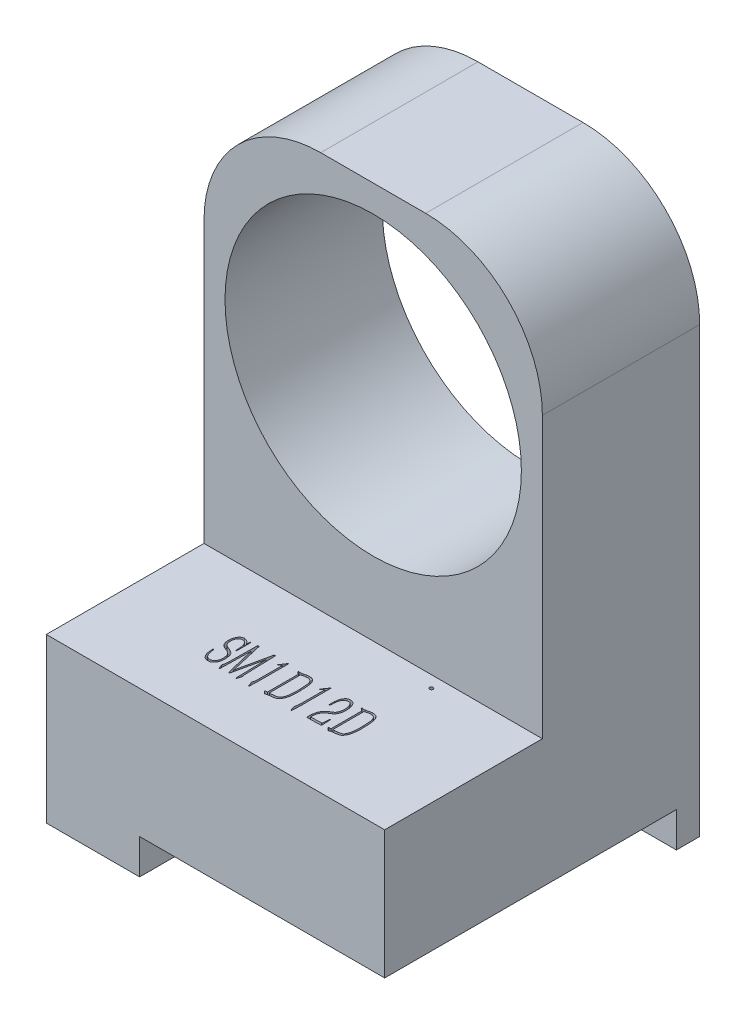
from build123d import *

# Parameters (mm, degrees)
SKETCH_1_W          = 29
SKETCH_1_H          = 29
EXTRUDE_1_DEPTH     = 5
SKETCH_2_W          = 25
SKETCH_2_H          = 25
CUT_EXTRUDE_1_DEPTH = 3
SKETCH_4_W          = 29
SKETCH_4_H          = 29
EXTRUDE_2_DEPTH     = 43
HOLE_WIZARD_M27_1_D = 25.4
CUT_EXTRUDE_START   = -15.516
SKETCH_10_R         = 18
CUT_EXTRUDE_2_DEPTH = 15.516
SKETCH_11_R         = 1
CUT_EXTRUDE_3_DEPTH = 3
CUT_EXTRUDE_4_DEPTH = 15.516
SKETCH_13_W         = 29
SKETCH_13_H         = 5
EXTRUDE_3_DEPTH     = 6
SKETCH_14_W         = 6
SKETCH_14_H         = 29
CUT_EXTRUDE_5_DEPTH = 50.794578018
SKETCH_15_W         = 29
SKETCH_15_H         = 2
CUT_EXTRUDE_6_DEPTH = 55.171025466
FILLET_1_R          = 10
CUT_EXTRUDE_7_REACH = 60.764
CUT_EXTRUDE_8_DEPTH = 0.5


with BuildPart() as part:
    # 草图1 → 凸台-拉伸1 (new body)
    with BuildSketch(Plane(origin=(0, 0, 0), x_dir=(1, 0, 0), z_dir=(0, 1, 0))):
        Rectangle(SKETCH_1_W, SKETCH_1_H)
    extrude(amount=EXTRUDE_1_DEPTH)

    # 草图2 → 切除-拉伸1 (cut)
    with BuildSketch(Plane.XZ):
        Rectangle(SKETCH_2_W, SKETCH_2_H)
    extrude(amount=-CUT_EXTRUDE_1_DEPTH, mode=Mode.SUBTRACT)

    # 草图4 → 凸台-拉伸2 (add)
    with BuildSketch(Plane(origin=(0, 5, 0), x_dir=(1, 0, 0), z_dir=(0, 1, 0))):
        with Locations((-6, 0)):
            Rectangle(SKETCH_4_W, SKETCH_4_H)
    extrude(amount=EXTRUDE_2_DEPTH)

    # 草图7 → M4 螺纹孔1 (revolve, cut)
    with BuildSketch(Plane(origin=(0, 3, 0), x_dir=(0, 0, -1), z_dir=(1, 0, 0))):
        Polygon((0, 0), (0, 11.091420021), (1.65, 10.1), (1.65, 0), align=None)
    revolve(axis=Axis((0, -3.35, 0), (0, 1, 0)), mode=Mode.SUBTRACT)

    # M27 螺纹孔1 (through all)
    with Locations(Plane(origin=(-6, 33, 14.5), x_dir=(1, 0, 0), z_dir=(0, 0, 1))):
        with Locations((0, 0)):
            Hole(HOLE_WIZARD_M27_1_D / 2)

    # 草图10 → 切除-拉伸2 (cut)
    with BuildSketch(Plane.XY.offset(14.5).offset(CUT_EXTRUDE_START)):
        with Locations((-6, 33)):
            Circle(SKETCH_10_R)
    extrude(amount=CUT_EXTRUDE_2_DEPTH, mode=Mode.SUBTRACT)

    # 草图11 → 切除-拉伸3 (cut)
    with BuildSketch(Plane(origin=(0, 0, 0), x_dir=(-1, 0, 0), z_dir=(0, -1, 0))):
        with Locations((12.5, 12.5)):
            Circle(SKETCH_11_R)
    extrude(amount=-CUT_EXTRUDE_3_DEPTH, mode=Mode.SUBTRACT)

    # 草图12 → 切除-拉伸4 (cut)
    with BuildSketch(Plane.XY.offset(14.5).offset(CUT_EXTRUDE_START)):
        with BuildLine():
            Line((-20.5, 48), (-20.5, 43.665364504))
            ThreePointArc((-20.5, 43.665364504), (-18.415569073, 46.032791128), (-15.949874371, 48))
            Line((-15.949874371, 48), (-20.5, 48))
        make_face()
        with BuildLine():
            Line((8.5, 48), (3.949874371, 48))
            ThreePointArc((3.949874371, 48), (6.415569073, 46.032791128), (8.5, 43.665364504))
            Line((8.5, 43.665364504), (8.5, 48))
        make_face()
    extrude(amount=CUT_EXTRUDE_4_DEPTH, mode=Mode.SUBTRACT)

    # 草图13 → 凸台-拉伸3 (add)
    with BuildSketch(Plane.ZY.offset(14.5)):
        with Locations((0, 2.5)):
            Rectangle(SKETCH_13_W, SKETCH_13_H)
    extrude(amount=EXTRUDE_3_DEPTH)

    # 草图14 → 切除-拉伸5 (cut, through all)
    with BuildSketch(Plane(origin=(0, 5, 0), x_dir=(1, 0, 0), z_dir=(0, 1, 0))):
        with Locations((11.5, 0)):
            Rectangle(SKETCH_14_W, SKETCH_14_H)
    extrude(amount=-CUT_EXTRUDE_5_DEPTH, mode=Mode.SUBTRACT)

    # 草图15 → 切除-拉伸6 (cut, through all)
    with BuildSketch(Plane.XZ):
        with Locations((-6, 13.5)):
            Rectangle(SKETCH_15_W, SKETCH_15_H)
    extrude(amount=-CUT_EXTRUDE_6_DEPTH, mode=Mode.SUBTRACT)

    # 圆角1
    fillet_1_edges = [part.edges().sort_by_distance(p)[0] for p in [
        (-20.5, 48, -7.758),
        (8.5, 48, -7.758),
    ]]
    fillet(fillet_1_edges, radius=FILLET_1_R)

    # 切除-拉伸7: up to this face of the body (flat: up to its plane)
    cut_extrude_7_end = Plane(part.part.faces().sort_by_distance((-6, 47.560682347, -1.016))[0])
    # 草图16 → 切除-拉伸7 (cut, up to the picked face)
    with BuildSketch(Plane.XY.offset(12.5), mode=Mode.PRIVATE) as cut_extrude_7_sk1:
        with BuildLine():
            Line((-20.5, 22.334635496), (-20.5, 14))
            Line((-20.5, 14), (8.5, 14))
            Line((8.5, 14), (8.5, 22.334635496))
            ThreePointArc((8.5, 22.334635496), (-6, 15), (-20.5, 22.334635496))
        make_face()
    cut_extrude_7_tool1 = split(extrude(cut_extrude_7_sk1.sketch, amount=-CUT_EXTRUDE_7_REACH, mode=Mode.PRIVATE), bisect_by=cut_extrude_7_end, keep=Keep.BOTH, mode=Mode.PRIVATE)
    add(cut_extrude_7_tool1.solids().sort_by(Axis((-20.198261, 18.167318, 12.5), (0, 0, -1)))[0], mode=Mode.SUBTRACT)

    # 草图17 → 切除-拉伸8 (cut)
    # profile 1 of 7: a face of its own
    with BuildSketch(Plane(origin=(0, 14, 0), x_dir=(1, 0, 0), z_dir=(0, 1, 0))):
        with BuildLine():
            Line((-11.230759471, -4.627887886), (-11.180045642, -4.320621745))
            Line((-11.180045642, -4.320621745), (-11.130077604, -4.325842286))
            Line((-11.130077604, -4.325842286), (-11.130077604, -5.583992723))
            Line((-11.130077604, -5.583992723), (-11.190486724, -5.589213264))
            Line((-11.190486724, -5.589213264), (-11.225538929, -5.055972267))
            add(Edge.make_bspline(
                [(-11.225538929, -5.055972267), (-11.230154048, -5.026320074), (-11.23868524, -4.971507064), (-11.255408188, -4.897277935), (-11.270918756, -4.836533639), (-11.29495314, -4.774974732), (-11.330618835, -4.709252596), (-11.383154237, -4.638808805), (-11.446187294, -4.575353336), (-11.520937108, -4.525436973), (-11.601955167, -4.48728667), (-11.660203779, -4.480036198), (-11.688675516, -4.47649219)],
                knots=[0, 0, 0, 0, 1.116474761, 2.063838624, 2.831507158, 3.446633667, 4.518832044, 5.603216916, 6.708904972, 7.82779241, 8.938231816, 10, 10, 10, 10], degree=3))
            add(Edge.make_bspline(
                [(-11.688675516, -4.47649219), (-11.705638791, -4.477219301), (-11.740466382, -4.478712143), (-11.784184532, -4.488994113), (-11.821442957, -4.502630548), (-11.852255832, -4.520174232), (-11.886147385, -4.543670742), (-11.921551588, -4.572839476), (-11.957151012, -4.606169407), (-11.988724336, -4.64490384), (-12.01644151, -4.687319718), (-12.046163147, -4.748459815), (-12.075759347, -4.826386556), (-12.095324484, -4.907097934), (-12.103876431, -4.974568079), (-12.109129452, -5.031531607), (-12.112502689, -5.095465788), (-12.11546211, -5.164596659), (-12.112918722, -5.235818315), (-12.102656267, -5.305466686), (-12.084179896, -5.371732423), (-12.065579187, -5.412912205), (-12.056350777, -5.433342819)],
                knots=[0, 0, 0, 0, 0.864038106, 1.773971445, 2.275285977, 2.88209936, 3.574564674, 4.376127188, 5.218616224, 6.055847121, 6.916999662, 7.795414815, 9.515900782, 11.157236165, 12.013901558, 12.981067707, 14.072720019, 15.277182195, 16.507433409, 17.699229733, 18.858513907, 20, 20, 20, 20], degree=3))
            add(Edge.make_bspline(
                [(-12.056350777, -5.433342819), (-12.045902313, -5.452288448), (-12.025526211, -5.489235322), (-11.98741809, -5.538424567), (-11.942663745, -5.578291249), (-11.879801158, -5.618908577), (-11.804396117, -5.655209814), (-11.744959602, -5.679212607), (-11.71850718, -5.689895131)],
                knots=[0, 0, 0, 0, 0.892298636, 1.740118821, 2.553971753, 3.353728668, 4.822268012, 6, 6, 6, 6], degree=3))
            Line((-11.71850718, -5.689895131), (-11.542500361, -5.760745333))
            add(Edge.make_bspline(
                [(-11.542500361, -5.760745333), (-11.520785551, -5.770759827), (-11.478975067, -5.790042096), (-11.420047043, -5.820717471), (-11.36669571, -5.851051349), (-11.305309901, -5.892136848), (-11.237670068, -5.946097972), (-11.170834456, -6.020518044), (-11.116524201, -6.104857081), (-11.082457437, -6.203195204), (-11.055626043, -6.309875611), (-11.037509207, -6.425768627), (-11.025547854, -6.552294289), (-11.020740111, -6.687660857), (-11.022869344, -6.827545569), (-11.04075077, -6.918862573), (-11.049532111, -6.963707191)],
                knots=[0, 0, 0, 0, 0.703245545, 1.354054533, 1.953549274, 2.507188807, 3.525842386, 4.488918984, 5.43838142, 6.454223102, 7.53246407, 8.673253088, 9.899948524, 11.268249991, 12.658472344, 14, 14, 14, 14], degree=3))
            add(Edge.make_bspline(
                [(-11.049532111, -6.963707191), (-11.060511527, -7.008680579), (-11.081777991, -7.095791302), (-11.127788535, -7.195874943), (-11.168119736, -7.266647726), (-11.197998015, -7.31251353), (-11.227874419, -7.351928977), (-11.266920779, -7.398185552), (-11.327141247, -7.446946465), (-11.397400281, -7.485775141), (-11.462073432, -7.509915701), (-11.515754477, -7.523717012), (-11.573390948, -7.530712447), (-11.613086271, -7.532055796), (-11.633486937, -7.532746186)],
                knots=[0, 0, 0, 0, 1.868422262, 3.619020558, 4.429541533, 5.162879566, 5.830420081, 6.429075538, 7.606854402, 8.938752151, 9.657684361, 10.394048182, 11.174651193, 12, 12, 12, 12], degree=3))
            add(Edge.make_bspline(
                [(-11.633486937, -7.532746186), (-11.656395889, -7.532600451), (-11.701235787, -7.532315204), (-11.766839553, -7.521704359), (-11.828747589, -7.502283782), (-11.886397581, -7.473407911), (-11.940315098, -7.437341889), (-11.99039047, -7.394559442), (-12.036702454, -7.34551203), (-12.080434533, -7.291148434), (-12.118740341, -7.229762329), (-12.153353475, -7.162999026), (-12.182959141, -7.090515171), (-12.216151675, -6.988216161), (-12.245319009, -6.858260176), (-12.253661679, -6.753046612), (-12.25771451, -6.701934338)],
                knots=[0, 0, 0, 0, 0.833862414, 1.63212638, 2.411403016, 3.189256699, 3.973153178, 4.770028097, 5.583768076, 6.428386665, 7.307987397, 8.215552436, 9.166047206, 10.157242313, 12.13320567, 14, 14, 14, 14], degree=3))
            Line((-12.25771451, -6.701934338), (-12.277850883, -6.434940944))
            Line((-12.277850883, -6.434940944), (-12.207000681, -6.434940944))
            add(Edge.make_bspline(
                [(-12.207000681, -6.434940944), (-12.202925157, -6.466534138), (-12.195084427, -6.527314972), (-12.181307669, -6.614992202), (-12.168028613, -6.695813655), (-12.1510542, -6.79240261), (-12.124499434, -6.901510469), (-12.082665171, -7.020084365), (-12.028035983, -7.124142569), (-11.969670913, -7.197240348), (-11.919478846, -7.248095515), (-11.87946501, -7.277292503), (-11.840486539, -7.302514596), (-11.787659457, -7.324087132), (-11.721836891, -7.341323784), (-11.668896165, -7.34115818), (-11.643182228, -7.341077743)],
                knots=[0, 0, 0, 0, 1.134650933, 2.182907786, 3.161205505, 4.052250561, 5.675932663, 7.155002512, 8.52184542, 9.839854562, 10.472309825, 11.060302883, 11.600982628, 12.120735338, 13.087218943, 14, 14, 14, 14], degree=3))
            add(Edge.make_bspline(
                [(-11.643182228, -7.341077743), (-11.620485304, -7.340266466), (-11.576946565, -7.33871022), (-11.514683758, -7.325495017), (-11.457966048, -7.305242878), (-11.407991444, -7.274158331), (-11.363173653, -7.236637803), (-11.322733624, -7.192753859), (-11.285670326, -7.143325943), (-11.254763081, -7.08783551), (-11.227477115, -7.030475855), (-11.205050965, -6.973465497), (-11.188415664, -6.917801751), (-11.17713747, -6.862853766), (-11.169487995, -6.806031606), (-11.16558978, -6.745496631), (-11.162746874, -6.679819602), (-11.164312653, -6.634565304), (-11.165129809, -6.610947762)],
                knots=[0, 0, 0, 0, 1.108065456, 2.12556444, 3.098260599, 4.035950869, 4.98490885, 5.94776606, 6.946521194, 7.996930623, 9.045863326, 10.049925535, 10.987930625, 11.881525266, 12.788809675, 13.787786499, 14.845478855, 16, 16, 16, 16], degree=3))
            add(Edge.make_bspline(
                [(-11.165129809, -6.610947762), (-11.167740786, -6.574086098), (-11.172613975, -6.505286594), (-11.188416593, -6.410595112), (-11.207706944, -6.331058315), (-11.233448328, -6.265682163), (-11.264721679, -6.211631861), (-11.297589, -6.163049501), (-11.334634172, -6.119729215), (-11.376843218, -6.081992007), (-11.423215236, -6.047009075), (-11.475427827, -6.014477505), (-11.533908224, -5.983574965), (-11.575907309, -5.966002161), (-11.59768894, -5.956888525)],
                knots=[0, 0, 0, 0, 1.578487453, 2.946127177, 4.097996722, 5.070650713, 5.936469873, 6.761635482, 7.575228913, 8.364955199, 9.176673428, 10.055112166, 10.991339211, 12, 12, 12, 12], degree=3))
            Line((-11.59768894, -5.956888525), (-11.814714297, -5.876343032))
            add(Edge.make_bspline(
                [(-11.814714297, -5.876343032), (-11.848485274, -5.861580497), (-11.915405385, -5.832327257), (-12.006745666, -5.773162931), (-12.086336427, -5.701541452), (-12.150428742, -5.614603316), (-12.19964637, -5.513380133), (-12.22971543, -5.418547096), (-12.246463568, -5.333346791), (-12.253915124, -5.260723641), (-12.258810356, -5.180833743), (-12.258091422, -5.125338969), (-12.25771451, -5.096245014)],
                knots=[0, 0, 0, 0, 1.141640751, 2.262259852, 3.359181592, 4.444772656, 5.58953336, 6.835542724, 7.519006772, 8.279340868, 9.097919025, 10, 10, 10, 10], degree=3))
            add(Edge.make_bspline(
                [(-12.25771451, -5.096245014), (-12.257501968, -5.07112757), (-12.257091106, -5.022573361), (-12.251869242, -4.952331104), (-12.242996471, -4.887593389), (-12.227098454, -4.808559849), (-12.19864979, -4.715745427), (-12.154457419, -4.611841173), (-12.103246691, -4.519032321), (-12.044373754, -4.441205344), (-11.977159363, -4.380355545), (-11.915965095, -4.338230618), (-11.860375154, -4.313211596), (-11.812707716, -4.299684036), (-11.759725923, -4.292796062), (-11.722750397, -4.291474734), (-11.703591348, -4.290790081)],
                knots=[0, 0, 0, 0, 0.971164436, 1.877345498, 2.721647718, 3.496542433, 4.992871533, 6.466013358, 7.856401207, 9.083219229, 10.219456221, 11.349985082, 11.939558551, 12.569451447, 13.258754286, 14, 14, 14, 14], degree=3))
            add(Edge.make_bspline(
                [(-11.703591348, -4.290790081), (-11.682117158, -4.29323293), (-11.63940792, -4.298091424), (-11.57676368, -4.315069609), (-11.516162598, -4.339447376), (-11.459566634, -4.372540608), (-11.40751592, -4.409389102), (-11.36068149, -4.447636166), (-11.322402784, -4.489018801), (-11.301337548, -4.51829424), (-11.291168591, -4.532426561)],
                knots=[0, 0, 0, 0, 1.049956055, 2.088219507, 3.145806661, 4.218152357, 5.268178035, 6.24663062, 7.15358473, 8, 8, 8, 8], degree=3))
            Line((-11.291168591, -4.532426561), (-11.230759471, -4.627887886))
        make_face()
    # profile 2 of 7: a face of its own
    with BuildSketch(Plane(origin=(0, 14, 0), x_dir=(1, 0, 0), z_dir=(0, 1, 0))):
        with BuildLine():
            Line((-9.209664222, -4.265433166), (-9.094066524, -4.265433166))
            Line((-9.094066524, -4.265433166), (-9.023962113, -6.626609386))
            Line((-9.023962113, -6.626609386), (-9.018741572, -6.848109493))
            add(Edge.make_bspline(
                [(-9.018741572, -6.848109493), (-9.018486663, -6.872722364), (-9.018053661, -6.914531131), (-9.014655278, -6.970663256), (-9.006934874, -7.017419387), (-8.997097796, -7.061872872), (-8.984070144, -7.104098519), (-8.970587225, -7.140371785), (-8.956837315, -7.166912875), (-8.949555741, -7.187951484), (-8.953001974, -7.20807972), (-8.958883315, -7.23363563), (-8.97266093, -7.270455813), (-8.982538051, -7.299294274), (-8.988164116, -7.315720829)],
                knots=[0, 0, 0, 0, 1.833532234, 3.114538037, 4.183068399, 5.360011406, 6.502211209, 7.47535404, 8.229329157, 8.745810393, 9.081162989, 9.727925243, 10.705812996, 12, 12, 12, 12], degree=3))
            Line((-8.988164116, -7.315720829), (-9.044098486, -7.487252898))
            add(Edge.make_bspline(
                [(-9.044098486, -7.487252898), (-9.050245826, -7.502940604), (-9.061109396, -7.530663896), (-9.075998395, -7.566250574), (-9.086458288, -7.590616144), (-9.096306938, -7.606234691), (-9.106836794, -7.614471339), (-9.119503478, -7.617324023), (-9.129210796, -7.609010386), (-9.132468192, -7.601782068), (-9.13433927, -7.597630055)],
                knots=[0, 0, 0, 0, 2.257142557, 3.988819353, 5.165733309, 5.812331029, 6.431774305, 6.935717094, 7.388666149, 8, 8, 8, 8], degree=3))
            add(Edge.make_bspline(
                [(-9.13433927, -7.597630055), (-9.137484025, -7.591528176), (-9.145486443, -7.576000802), (-9.145549358, -7.543229879), (-9.145485078, -7.49940859), (-9.141696463, -7.465885854), (-9.139559812, -7.446980151)],
                knots=[0, 0, 0, 0, 0.533370556, 1.357261302, 2.50958371, 4, 4, 4, 4], degree=3))
            Line((-9.139559812, -7.446980151), (-9.149255102, -7.130018719))
            Line((-9.149255102, -7.130018719), (-9.209664222, -4.950069859))
            Line((-9.209664222, -4.950069859), (-9.773482675, -7.507389271))
            Line((-9.773482675, -7.507389271), (-9.869689792, -7.50216873))
            Line((-9.869689792, -7.50216873), (-10.478255742, -4.979901523))
            Line((-10.478255742, -4.979901523), (-10.518528488, -7.154629842))
            Line((-10.518528488, -7.154629842), (-10.528969571, -7.467116524))
            add(Edge.make_bspline(
                [(-10.528969571, -7.467116524), (-10.529091888, -7.489802118), (-10.529310727, -7.530388901), (-10.536542342, -7.576976696), (-10.543678383, -7.60590114), (-10.54916414, -7.618939465), (-10.555524457, -7.628598208), (-10.561364856, -7.628329673), (-10.564021776, -7.628207511)],
                knots=[0, 0, 0, 0, 2.35867652, 4.21990684, 4.917432392, 5.427710553, 5.739653463, 6, 6, 6, 6], degree=3))
            add(Edge.make_bspline(
                [(-10.564021776, -7.628207511), (-10.567520782, -7.627609188), (-10.574844959, -7.626356767), (-10.588609068, -7.620152711), (-10.599048768, -7.596752965), (-10.607804963, -7.571074394), (-10.615825648, -7.546000526), (-10.619973439, -7.529963573), (-10.623590453, -7.519709274), (-10.624223846, -7.514358825), (-10.624430896, -7.512609812)],
                knots=[0, 0, 0, 0, 0.61831469, 1.294266409, 2.516485019, 4.811391437, 6.122679461, 7.065853468, 7.69463614, 8, 8, 8, 8], degree=3))
            Line((-10.624430896, -7.512609812), (-10.715417472, -7.285889165))
            add(Edge.make_bspline(
                [(-10.715417472, -7.285889165), (-10.717873706, -7.274514324), (-10.722697828, -7.252173772), (-10.721798053, -7.216757798), (-10.712269383, -7.17933894), (-10.698061762, -7.140407806), (-10.683606493, -7.104756316), (-10.673337322, -7.078595541), (-10.667505891, -7.058664738), (-10.665286306, -7.038541343), (-10.661891267, -7.012265601), (-10.660255333, -6.981351541), (-10.658395147, -6.950500781), (-10.655712852, -6.923956074), (-10.654687474, -6.904004199), (-10.652893383, -6.890135631), (-10.651797316, -6.878205757), (-10.651150396, -6.864024052), (-10.650621427, -6.843620225), (-10.648580159, -6.81706245), (-10.648585901, -6.784202566), (-10.646353762, -6.745458683), (-10.646287824, -6.700431065), (-10.645166908, -6.668371103), (-10.644567269, -6.651220509)],
                knots=[0, 0, 0, 0, 1.187984124, 2.333238898, 3.586201942, 5.123185855, 6.573707022, 7.523685523, 7.99901539, 8.693496643, 9.589827362, 10.711954829, 11.85946849, 12.753267707, 13.442133117, 13.902940376, 14.183976602, 14.668078378, 15.355532658, 16.272922794, 17.392740166, 18.716797284, 20.243638767, 22, 22, 22, 22], degree=3))
            Line((-10.644567269, -6.651220509), (-10.609515064, -4.265433166))
            Line((-10.609515064, -4.265433166), (-10.488696824, -4.265433166))
            Line((-10.488696824, -4.265433166), (-9.829417046, -7.114357096))
            Line((-9.829417046, -7.114357096), (-9.209664222, -4.265433166))
        make_face()
    # profile 3 of 7: a face of its own
    with BuildSketch(Plane(origin=(0, 14, 0), x_dir=(1, 0, 0), z_dir=(0, 1, 0))):
        with BuildLine():
            Line((-7.990294949, -4.29526483), (-7.93510637, -4.29526483))
            Line((-7.93510637, -4.29526483), (-7.940326912, -6.968927733))
            add(Edge.make_bspline(
                [(-7.940326912, -6.968927733), (-7.940921629, -6.993040022), (-7.942061934, -7.039272652), (-7.942154479, -7.105419556), (-7.944329891, -7.165309442), (-7.944503162, -7.219028056), (-7.946120764, -7.266505221), (-7.947991364, -7.30775087), (-7.948169106, -7.342842319), (-7.951477863, -7.397764965), (-7.955420686, -7.473279508), (-7.965198681, -7.551058203), (-7.972982701, -7.606478779), (-7.980895798, -7.631707193), (-7.990920881, -7.651668741), (-8.000925894, -7.649340857), (-8.005210781, -7.648343884)],
                knots=[0, 0, 0, 0, 1.45038606, 2.780953852, 3.977268029, 5.053718292, 6.010937745, 6.833690271, 7.536464333, 8.120251454, 10.142880859, 12.069479857, 12.873132744, 13.440417135, 13.76034519, 14, 14, 14, 14], degree=3))
            add(Edge.make_bspline(
                [(-8.005210781, -7.648343884), (-8.00620131, -7.647594122), (-8.010441017, -7.644384954), (-8.020551544, -7.637592327), (-8.032564936, -7.619384287), (-8.037823648, -7.60304923), (-8.041008778, -7.593155306)],
                knots=[0, 0, 0, 0, 0.221265066, 0.947068446, 2.150880552, 4, 4, 4, 4], degree=3))
            Line((-8.041008778, -7.593155306), (-8.065619901, -7.527525644))
            Line((-8.065619901, -7.527525644), (-8.121554271, -7.346298285))
            add(Edge.make_bspline(
                [(-8.121554271, -7.346298285), (-8.128287563, -7.329246657), (-8.14001661, -7.299543603), (-8.151848629, -7.260465109), (-8.160824798, -7.23551184), (-8.163210592, -7.21528613), (-8.151718214, -7.196314361), (-8.143254472, -7.167103621), (-8.130231035, -7.129818033), (-8.117932449, -7.085810936), (-8.107069898, -7.038261963), (-8.097284633, -6.986886792), (-8.091739042, -6.929004059), (-8.089018714, -6.8737382), (-8.086931024, -6.820528765), (-8.086551723, -6.769302902), (-8.08550556, -6.708649913), (-8.085668991, -6.664894029), (-8.085756274, -6.641525218)],
                knots=[0, 0, 0, 0, 1.220359697, 2.125803599, 2.712350858, 2.994193817, 3.439826662, 4.12562012, 5.031064022, 6.063176816, 7.167225426, 8.277459231, 9.542238136, 11.034069985, 11.961482632, 13.08703073, 14.444263491, 16, 16, 16, 16], degree=3))
            Line((-8.085756274, -6.641525218), (-8.081281525, -4.668160633))
            Line((-8.081281525, -4.668160633), (-8.343054378, -4.89488128))
            Line((-8.343054378, -4.89488128), (-8.363190751, -4.809115246))
            add(Edge.make_bspline(
                [(-8.363190751, -4.809115246), (-8.341912313, -4.787128127), (-8.302025001, -4.745912365), (-8.248717873, -4.686569076), (-8.204874624, -4.635068501), (-8.159208956, -4.574861915), (-8.108081031, -4.499935194), (-8.070324671, -4.438377215), (-8.050704069, -4.40638778)],
                knots=[0, 0, 0, 0, 1.077185482, 2.019228619, 2.808185376, 3.45765616, 4.678836699, 6, 6, 6, 6], degree=3))
            Line((-8.050704069, -4.40638778), (-7.990294949, -4.29526483))
        make_face()
    # profile 4 of 7: a face of its own
    with BuildSketch(Plane(origin=(0, 14, 0), x_dir=(1, 0, 0), z_dir=(0, 1, 0))):
        with BuildLine():
            add(Edge.make_bspline(
                [(-6.745568761, -4.65771955), (-6.758694537, -4.65186981), (-6.781418253, -4.641742573), (-6.802355178, -4.628331748), (-6.811198422, -4.622667345)],
                knots=[0, 0, 0, 0, 1.155249011, 2, 2, 2, 2], degree=3))
            Line((-6.811198422, -4.622667345), (-6.901439206, -4.547342393))
            add(Edge.make_bspline(
                [(-6.901439206, -4.547342393), (-6.910264734, -4.540810869), (-6.926264631, -4.528969795), (-6.943226051, -4.506841468), (-6.949541882, -4.484521775), (-6.947964882, -4.464623306), (-6.940757653, -4.447355128), (-6.931396051, -4.439888337), (-6.926796121, -4.436219444)],
                knots=[0, 0, 0, 0, 1.447871613, 2.624862772, 3.613765279, 4.438196654, 5.232590026, 6, 6, 6, 6], degree=3))
            Line((-6.926796121, -4.436219444), (-6.835809545, -4.451881067))
            Line((-6.835809545, -4.451881067), (-6.730652929, -4.451881067))
            add(Edge.make_bspline(
                [(-6.730652929, -4.451881067), (-6.728911487, -4.451640352), (-6.721663123, -4.450638429), (-6.705529985, -4.447467913), (-6.678746896, -4.442170139), (-6.65732681, -4.438405685), (-6.644886894, -4.436219444)],
                knots=[0, 0, 0, 0, 0.241932977, 1.006992227, 2.261782692, 4, 4, 4, 4], degree=3))
            Line((-6.644886894, -4.436219444), (-6.538984487, -4.426524153))
            Line((-6.538984487, -4.426524153), (-6.348061836, -4.371335574))
            add(Edge.make_bspline(
                [(-6.348061836, -4.371335574), (-6.332196779, -4.367390771), (-6.298952758, -4.359124735), (-6.245824395, -4.35061069), (-6.187873228, -4.343634812), (-6.147465176, -4.341738894), (-6.126561729, -4.340758118)],
                knots=[0, 0, 0, 0, 0.875268756, 1.834059148, 2.879539399, 4, 4, 4, 4], degree=3))
            add(Edge.make_bspline(
                [(-6.126561729, -4.340758118), (-6.105417364, -4.340980504), (-6.065065944, -4.341404899), (-6.007130535, -4.346343303), (-5.954118224, -4.352267684), (-5.891201643, -4.366378861), (-5.818441901, -4.390838435), (-5.741467529, -4.439669621), (-5.674140997, -4.503643398), (-5.626800519, -4.568883197), (-5.593535714, -4.628971069), (-5.569640877, -4.680480142), (-5.548263713, -4.73790561), (-5.529002232, -4.801004927), (-5.511106788, -4.869378428), (-5.495419619, -4.943785127), (-5.482135164, -5.024175536), (-5.467829814, -5.138014005), (-5.45390159, -5.280912936), (-5.446987533, -5.450964289), (-5.441099197, -5.621037129), (-5.436089282, -5.763505362), (-5.430537236, -5.875571275), (-5.428533398, -5.952160043), (-5.426917609, -6.020274946), (-5.426471082, -6.063038816), (-5.426263413, -6.082927306)],
                knots=[0, 0, 0, 0, 0.718585689, 1.371332375, 1.976198466, 2.529891817, 3.561749994, 4.56781114, 5.602123862, 6.702587104, 7.292809697, 7.935632291, 8.631030849, 9.374196065, 10.177765977, 11.033092299, 11.958456765, 12.947006156, 14.933404235, 16.837287687, 18.73165533, 20.719239715, 21.683649529, 22.54608654, 23.323818374, 24, 24, 24, 24], degree=3))
            add(Edge.make_bspline(
                [(-5.426263413, -6.082927306), (-5.427248305, -6.105052763), (-5.429340084, -6.152044238), (-5.432865453, -6.226650745), (-5.43846999, -6.309400016), (-5.445789349, -6.429419772), (-5.459871461, -6.582143725), (-5.487339026, -6.732047182), (-5.514389493, -6.848055542), (-5.541501084, -6.930348622), (-5.572900394, -7.009421625), (-5.60890455, -7.083650696), (-5.648345322, -7.151986062), (-5.688886294, -7.213038478), (-5.731038306, -7.266207601), (-5.77490186, -7.311121062), (-5.821297466, -7.348717604), (-5.870978916, -7.378790279), (-5.924182132, -7.402019484), (-5.98271251, -7.418730018), (-6.049518535, -7.430963778), (-6.128225061, -7.442528659), (-6.220652343, -7.455445141), (-6.287135675, -7.463048599), (-6.322704921, -7.467116524)],
                knots=[0, 0, 0, 0, 0.774403953, 1.64472916, 2.611501509, 3.674251025, 5.849538744, 7.968932488, 8.997760875, 10.012092789, 10.995102175, 11.970898344, 12.893807862, 13.752068917, 14.531287561, 15.26274097, 15.942861734, 16.613698282, 17.287120385, 17.96651865, 18.737058996, 19.660295931, 20.748234995, 22, 22, 22, 22], degree=3))
            Line((-6.322704921, -7.467116524), (-6.544205028, -7.492473439))
            add(Edge.make_bspline(
                [(-6.544205028, -7.492473439), (-6.565413656, -7.496095409), (-6.604134653, -7.502708108), (-6.646095525, -7.523567798), (-6.671003079, -7.540699695), (-6.68437155, -7.549812935), (-6.693545934, -7.555358039), (-6.69856907, -7.556896065), (-6.700075473, -7.557357309)],
                knots=[0, 0, 0, 0, 2.258427549, 4.123254342, 4.879658115, 5.446960944, 5.834147501, 6, 6, 6, 6], degree=3))
            add(Edge.make_bspline(
                [(-6.700075473, -7.557357309), (-6.704391961, -7.557454482), (-6.715284106, -7.557699686), (-6.731965266, -7.546126131), (-6.75438372, -7.531638173), (-6.778622115, -7.509580921), (-6.802810453, -7.486592934), (-6.82401411, -7.466508923), (-6.839633021, -7.450275282), (-6.848020363, -7.440543159), (-6.851471169, -7.436539069)],
                knots=[0, 0, 0, 0, 0.515294809, 1.300285127, 2.366249425, 3.803798064, 5.259385994, 6.436385369, 7.356681581, 8, 8, 8, 8], degree=3))
            Line((-6.851471169, -7.436539069), (-6.911880289, -7.371655199))
            add(Edge.make_bspline(
                [(-6.911880289, -7.371655199), (-6.920755418, -7.362205246), (-6.934428127, -7.347646982), (-6.947555727, -7.323213122), (-6.940814638, -7.308541643), (-6.934647702, -7.296425911), (-6.916902657, -7.292667935), (-6.904254696, -7.294451345), (-6.896218665, -7.295584455)],
                knots=[0, 0, 0, 0, 1.90810625, 2.939560931, 3.619271678, 4.135931338, 4.815642084, 6, 6, 6, 6], degree=3))
            Line((-6.896218665, -7.295584455), (-6.826114254, -7.295584455))
            Line((-6.826114254, -7.295584455), (-6.745568761, -7.295584455))
            Line((-6.745568761, -7.295584455), (-6.745568761, -4.65771955))
        make_face()
        with BuildLine():
            add(Edge.make_bspline(
                [(-6.604614148, -7.285889165), (-6.588210423, -7.286879598), (-6.557654457, -7.288724523), (-6.515127418, -7.287749193), (-6.479510421, -7.288915869), (-6.458183548, -7.286817818), (-6.448743702, -7.285889165)],
                knots=[0, 0, 0, 0, 1.263335509, 2.353272607, 3.271114373, 4, 4, 4, 4], degree=3))
            Line((-6.448743702, -7.285889165), (-6.227243596, -7.26053225))
            add(Edge.make_bspline(
                [(-6.227243596, -7.26053225), (-6.198382077, -7.257537172), (-6.142976251, -7.251787482), (-6.063787219, -7.239771553), (-5.992637639, -7.222196959), (-5.92776253, -7.202193508), (-5.869009944, -7.172792189), (-5.817602219, -7.130512683), (-5.772119168, -7.076439826), (-5.735221245, -7.011231313), (-5.702974, -6.941508617), (-5.673157305, -6.872074322), (-5.651226203, -6.802876344), (-5.626708371, -6.711232185), (-5.604019709, -6.590481199), (-5.583200298, -6.435153899), (-5.568877801, -6.263667497), (-5.564142789, -6.073760756), (-5.563590652, -5.863903096), (-5.565969954, -5.716990607), (-5.567218026, -5.639927093)],
                knots=[0, 0, 0, 0, 0.792675974, 1.52171018, 2.185483906, 2.793222177, 3.373317832, 3.96724032, 4.598502022, 5.292637146, 6.0064898, 6.697595424, 7.354735785, 7.987274644, 9.288454635, 10.706973044, 12.26743299, 13.986389814, 15.894645254, 18, 18, 18, 18], degree=3))
            add(Edge.make_bspline(
                [(-5.567218026, -5.639927093), (-5.568922505, -5.611087564), (-5.572449487, -5.551411575), (-5.578626867, -5.458962545), (-5.584626637, -5.360269328), (-5.590080377, -5.25778895), (-5.596778016, -5.156973204), (-5.607092773, -5.063638224), (-5.620320092, -4.980454955), (-5.636637696, -4.906677688), (-5.656316684, -4.840636334), (-5.678950265, -4.780617892), (-5.706894794, -4.727020665), (-5.737284295, -4.678446922), (-5.772487403, -4.636359756), (-5.81188828, -4.600967968), (-5.856376239, -4.573268789), (-5.918653026, -4.548855011), (-5.991892824, -4.5277608), (-6.04988484, -4.520165401), (-6.0758479, -4.516764937)],
                knots=[0, 0, 0, 0, 1.134903754, 2.348391475, 3.639854006, 5.019058801, 6.380025606, 7.608394198, 8.706568192, 9.687444568, 10.574206556, 11.412083321, 12.202637834, 12.944909566, 13.658888821, 14.35068326, 15.017343718, 15.704712398, 16.972398388, 18, 18, 18, 18], degree=3))
            add(Edge.make_bspline(
                [(-6.0758479, -4.516764937), (-6.093505492, -4.516189796), (-6.130351293, -4.514989659), (-6.188304419, -4.519823442), (-6.251399971, -4.525769085), (-6.316574498, -4.537472462), (-6.378757669, -4.54869945), (-6.432393949, -4.559423706), (-6.474719961, -4.570489136), (-6.49874858, -4.578797241), (-6.509152822, -4.582394598)],
                knots=[0, 0, 0, 0, 0.962606207, 2.0086543, 3.167397159, 4.417684765, 5.616878664, 6.613902928, 7.399828632, 8, 8, 8, 8], degree=3))
            Line((-6.509152822, -4.582394598), (-6.604614148, -4.622667345))
            Line((-6.604614148, -4.622667345), (-6.604614148, -7.285889165))
        make_face(mode=Mode.SUBTRACT)
    # profile 5 of 7: a face of its own
    with BuildSketch(Plane(origin=(0, 14, 0), x_dir=(1, 0, 0), z_dir=(0, 1, 0))):
        with BuildLine():
            Line((-4.362764585, -4.29526483), (-4.307576006, -4.29526483))
            Line((-4.307576006, -4.29526483), (-4.312796547, -6.968927733))
            add(Edge.make_bspline(
                [(-4.312796547, -6.968927733), (-4.313391265, -6.993040022), (-4.314531569, -7.039272652), (-4.314624114, -7.105419556), (-4.316799526, -7.165309442), (-4.316972798, -7.219028056), (-4.318590399, -7.266505221), (-4.320460999, -7.30775087), (-4.320638742, -7.342842319), (-4.323947499, -7.397764965), (-4.327890321, -7.473279508), (-4.337668317, -7.551058203), (-4.345452336, -7.606478779), (-4.353365434, -7.631707193), (-4.363390517, -7.651668741), (-4.37339553, -7.649340857), (-4.377680417, -7.648343884)],
                knots=[0, 0, 0, 0, 1.45038606, 2.780953852, 3.977268029, 5.053718292, 6.010937745, 6.833690271, 7.536464333, 8.120251454, 10.142880859, 12.069479857, 12.873132744, 13.440417135, 13.76034519, 14, 14, 14, 14], degree=3))
            add(Edge.make_bspline(
                [(-4.377680417, -7.648343884), (-4.378670946, -7.647594122), (-4.382910653, -7.644384954), (-4.39302118, -7.637592327), (-4.405034572, -7.619384287), (-4.410293283, -7.60304923), (-4.413478414, -7.593155306)],
                knots=[0, 0, 0, 0, 0.221265066, 0.947068446, 2.150880552, 4, 4, 4, 4], degree=3))
            Line((-4.413478414, -7.593155306), (-4.438089537, -7.527525644))
            Line((-4.438089537, -7.527525644), (-4.494023907, -7.346298285))
            add(Edge.make_bspline(
                [(-4.494023907, -7.346298285), (-4.500757199, -7.329246657), (-4.512486246, -7.299543603), (-4.524318265, -7.260465109), (-4.533294434, -7.23551184), (-4.535680227, -7.21528613), (-4.52418785, -7.196314361), (-4.515724108, -7.167103621), (-4.502700671, -7.129818033), (-4.490402085, -7.085810936), (-4.479539533, -7.038261963), (-4.469754268, -6.986886792), (-4.464208678, -6.929004059), (-4.46148835, -6.8737382), (-4.45940066, -6.820528765), (-4.459021359, -6.769302902), (-4.457975196, -6.708649913), (-4.458138626, -6.664894029), (-4.45822591, -6.641525218)],
                knots=[0, 0, 0, 0, 1.220359697, 2.125803599, 2.712350858, 2.994193817, 3.439826662, 4.12562012, 5.031064022, 6.063176816, 7.167225426, 8.277459231, 9.542238136, 11.034069985, 11.961482632, 13.08703073, 14.444263491, 16, 16, 16, 16], degree=3))
            Line((-4.45822591, -6.641525218), (-4.45375116, -4.668160633))
            Line((-4.45375116, -4.668160633), (-4.715524014, -4.89488128))
            Line((-4.715524014, -4.89488128), (-4.735660387, -4.809115246))
            add(Edge.make_bspline(
                [(-4.735660387, -4.809115246), (-4.714381948, -4.787128127), (-4.674494637, -4.745912365), (-4.621187508, -4.686569076), (-4.57734426, -4.635068501), (-4.531678592, -4.574861915), (-4.480550666, -4.499935194), (-4.442794307, -4.438377215), (-4.423173705, -4.40638778)],
                knots=[0, 0, 0, 0, 1.077185482, 2.019228619, 2.808185376, 3.45765616, 4.678836699, 6, 6, 6, 6], degree=3))
            Line((-4.423173705, -4.40638778), (-4.362764585, -4.29526483))
        make_face()
    # profile 6 of 7: a face of its own
    with BuildSketch(Plane(origin=(0, 14, 0), x_dir=(1, 0, 0), z_dir=(0, 1, 0))):
        with BuildLine():
            Line((-3.087460941, -5.594433806), (-3.163531685, -5.594433806))
            add(Edge.make_bspline(
                [(-3.163531685, -5.594433806), (-3.165099089, -5.570324551), (-3.16808722, -5.524362165), (-3.171170564, -5.45872289), (-3.172472675, -5.399786847), (-3.173777092, -5.327936904), (-3.171765353, -5.237325043), (-3.166363665, -5.164340695), (-3.163531685, -5.126076678)],
                knots=[0, 0, 0, 0, 0.927540379, 1.768282303, 2.522502339, 3.190652681, 4.527123766, 6, 6, 6, 6], degree=3))
            add(Edge.make_bspline(
                [(-3.163531685, -5.126076678), (-3.161571777, -5.0977104), (-3.157781541, -5.042853271), (-3.147778537, -4.963790765), (-3.13620203, -4.890526389), (-3.121151475, -4.821615835), (-3.100815695, -4.754179974), (-3.071865513, -4.68635112), (-3.03575918, -4.615806055), (-2.993100509, -4.54501411), (-2.946293871, -4.478216227), (-2.893755363, -4.423858979), (-2.838769543, -4.382427781), (-2.780265935, -4.357769906), (-2.724093997, -4.342436224), (-2.672869792, -4.33037465), (-2.626838212, -4.32194524), (-2.597755481, -4.321045639), (-2.584051608, -4.320621745)],
                knots=[0, 0, 0, 0, 1.238521709, 2.395159043, 3.470603583, 4.46912877, 5.466066804, 6.534123646, 7.677244524, 8.916145015, 10.13365226, 11.221244199, 12.198275335, 13.109907183, 13.966820176, 14.733954848, 15.403435577, 16, 16, 16, 16], degree=3))
            add(Edge.make_bspline(
                [(-2.584051608, -4.320621745), (-2.566587413, -4.321909427), (-2.532078703, -4.324453847), (-2.481317347, -4.336242841), (-2.432292296, -4.353240811), (-2.369587601, -4.383520832), (-2.296264553, -4.43099573), (-2.233886174, -4.493338133), (-2.190722107, -4.55040445), (-2.160317255, -4.598972298), (-2.133373757, -4.653205053), (-2.099537654, -4.732007091), (-2.064140385, -4.836578114), (-2.038613684, -4.96865204), (-2.022246592, -5.105804933), (-2.014758126, -5.246016494), (-2.013365726, -5.384846111), (-2.02151746, -5.475388535), (-2.025453696, -5.519108853)],
                knots=[0, 0, 0, 0, 0.570779476, 1.127842599, 1.694919432, 2.261066821, 3.397481896, 4.527710891, 5.118384485, 5.730727279, 6.394748858, 7.092559246, 8.529363642, 9.986910621, 11.474321506, 13.03467297, 14.568129345, 16, 16, 16, 16], degree=3))
            add(Edge.make_bspline(
                [(-2.025453696, -5.519108853), (-2.033433071, -5.564081101), (-2.049510874, -5.65469659), (-2.08414056, -5.763796388), (-2.116436668, -5.846740352), (-2.143437909, -5.902321256), (-2.172288469, -5.951525844), (-2.214006206, -6.009715145), (-2.277714639, -6.075766505), (-2.336750897, -6.120061312), (-2.367772043, -6.143336426)],
                knots=[0, 0, 0, 0, 1.490916612, 3.004077927, 3.729534125, 4.397912905, 5.020560084, 5.590839424, 6.734084393, 8, 8, 8, 8], degree=3))
            Line((-2.367772043, -6.143336426), (-2.614629064, -6.299206872))
            add(Edge.make_bspline(
                [(-2.614629064, -6.299206872), (-2.646086068, -6.320562636), (-2.705734551, -6.361057242), (-2.785381744, -6.427203275), (-2.852232244, -6.49689936), (-2.902761339, -6.573962608), (-2.94200625, -6.653288407), (-2.976854483, -6.732939264), (-3.003163127, -6.820732841), (-3.021874857, -6.899424695), (-3.034635638, -6.965514014), (-3.041027769, -7.011606115), (-3.046220509, -7.052342877), (-3.046879123, -7.077799697), (-3.047188194, -7.089745973)],
                knots=[0, 0, 0, 0, 1.453572249, 2.75625039, 3.953730064, 5.132566341, 6.263730064, 7.337486329, 8.453238547, 9.76321854, 10.430854957, 11.026567013, 11.543191201, 12, 12, 12, 12], degree=3))
            Line((-3.047188194, -7.089745973), (-3.057629277, -7.300804997))
            Line((-3.057629277, -7.300804997), (-2.156713018, -7.270973332))
            add(Edge.make_bspline(
                [(-2.156713018, -7.270973332), (-2.14515274, -7.270326968), (-2.1248483, -7.269191695), (-2.105334485, -7.247918308), (-2.100990935, -7.221943488), (-2.093283577, -7.189995206), (-2.087553684, -7.144200195), (-2.083133473, -7.109373841), (-2.080642275, -7.089745973)],
                knots=[0, 0, 0, 0, 0.925905201, 1.626257371, 2.181371879, 3.087088273, 4.358305093, 6, 6, 6, 6], degree=3))
            Line((-2.080642275, -7.089745973), (-2.060505902, -6.651220509))
            Line((-2.060505902, -6.651220509), (-1.990401491, -6.651220509))
            Line((-1.990401491, -6.651220509), (-1.965044576, -7.315720829))
            add(Edge.make_bspline(
                [(-1.965044576, -7.315720829), (-1.964196881, -7.328639439), (-1.962714261, -7.351234102), (-1.961992541, -7.381123575), (-1.961972114, -7.401936098), (-1.962286882, -7.418740098), (-1.967699073, -7.433432153), (-1.972728085, -7.450479772), (-1.992345793, -7.460110873), (-2.020544856, -7.463192402), (-2.063401161, -7.467556678), (-2.097037009, -7.467277546), (-2.116440272, -7.467116524)],
                knots=[0, 0, 0, 0, 1.385018147, 2.4223982, 3.193529914, 3.619812046, 4.200562765, 4.878496499, 5.402948042, 6.404258339, 7.925751149, 10, 10, 10, 10], degree=3))
            Line((-2.116440272, -7.467116524), (-3.118038397, -7.492473439))
            add(Edge.make_bspline(
                [(-3.118038397, -7.492473439), (-3.130213836, -7.492509058), (-3.154212526, -7.492579265), (-3.17880552, -7.468715291), (-3.189129152, -7.439501147), (-3.194296088, -7.405139452), (-3.197757026, -7.359552859), (-3.199419446, -7.28114672), (-3.195865244, -7.169586834), (-3.187859503, -7.077532408), (-3.183668058, -7.029336853)],
                knots=[0, 0, 0, 0, 0.556373901, 1.096654043, 1.476064089, 2.012759395, 2.73145082, 3.635924119, 5.715166189, 8, 8, 8, 8], degree=3))
            add(Edge.make_bspline(
                [(-3.183668058, -7.029336853), (-3.179948498, -7.001205171), (-3.172783334, -6.947013788), (-3.158214879, -6.869008059), (-3.142682544, -6.796601279), (-3.125825861, -6.729837257), (-3.107216911, -6.669067719), (-3.086905295, -6.614362237), (-3.065849174, -6.564839753), (-3.03422179, -6.508816864), (-2.994025845, -6.447750029), (-2.948305166, -6.38190528), (-2.904285056, -6.326051251), (-2.846748626, -6.264602816), (-2.768855317, -6.197531238), (-2.703419981, -6.148419765), (-2.669817642, -6.123200053)],
                knots=[0, 0, 0, 0, 1.103491021, 2.125706759, 3.085324024, 3.98349739, 4.803138144, 5.555704107, 6.252741852, 6.89323317, 8.054555834, 9.09539633, 10.010480884, 10.817709087, 12.365830683, 14, 14, 14, 14], degree=3))
            Line((-2.669817642, -6.123200053), (-2.463233368, -5.991940731))
            add(Edge.make_bspline(
                [(-2.463233368, -5.991940731), (-2.446694087, -5.980944411), (-2.414955409, -5.959842609), (-2.371117554, -5.926246829), (-2.333744138, -5.891388817), (-2.301536947, -5.85377247), (-2.272381393, -5.810245022), (-2.248437083, -5.75598874), (-2.223123605, -5.692080064), (-2.193609495, -5.592650105), (-2.163178314, -5.461411301), (-2.151512698, -5.29926059), (-2.157744576, -5.135006995), (-2.1767966, -5.025986981), (-2.186544683, -4.970206233)],
                knots=[0, 0, 0, 0, 0.635613896, 1.219735276, 1.765761318, 2.268061313, 2.802129131, 3.435697723, 4.161225462, 5.001884758, 6.75303811, 8.46119913, 10.189351173, 12, 12, 12, 12], degree=3))
            add(Edge.make_bspline(
                [(-2.186544683, -4.970206233), (-2.193890028, -4.941769232), (-2.208215892, -4.886307638), (-2.235330632, -4.80641305), (-2.270429002, -4.733646979), (-2.307996519, -4.665672295), (-2.355061516, -4.60617096), (-2.417752802, -4.563437166), (-2.491814049, -4.534870611), (-2.545987985, -4.529840205), (-2.574356317, -4.527206019)],
                knots=[0, 0, 0, 0, 1.101106684, 2.147523679, 3.156537618, 4.125318695, 5.058520457, 5.968677808, 6.93629249, 8, 8, 8, 8], degree=3))
            add(Edge.make_bspline(
                [(-2.574356317, -4.527206019), (-2.589288713, -4.527053143), (-2.619072424, -4.52674822), (-2.663433946, -4.533475521), (-2.706581638, -4.547580839), (-2.763260054, -4.573145946), (-2.828753104, -4.62076682), (-2.897689465, -4.692617694), (-2.954551002, -4.780349177), (-2.99833003, -4.882013963), (-3.0312486, -4.997837869), (-3.057972035, -5.127645002), (-3.075519412, -5.273081473), (-3.080421849, -5.374876074), (-3.082986191, -5.428122278)],
                knots=[0, 0, 0, 0, 0.469335518, 0.936122588, 1.403629858, 1.893624907, 2.887406355, 3.927357629, 5.011993806, 6.157121359, 7.396943717, 8.794309501, 10.323183677, 12, 12, 12, 12], degree=3))
            Line((-3.082986191, -5.428122278), (-3.087460941, -5.594433806))
        make_face()
    # profile 7 of 7: a face of its own
    with BuildSketch(Plane(origin=(0, 14, 0), x_dir=(1, 0, 0), z_dir=(0, 1, 0))):
        with BuildLine():
            add(Edge.make_bspline(
                [(-1.304273215, -4.65771955), (-1.31739899, -4.65186981), (-1.340122707, -4.641742573), (-1.361059632, -4.628331748), (-1.369902876, -4.622667345)],
                knots=[0, 0, 0, 0, 1.155249011, 2, 2, 2, 2], degree=3))
            Line((-1.369902876, -4.622667345), (-1.46014366, -4.547342393))
            add(Edge.make_bspline(
                [(-1.46014366, -4.547342393), (-1.468969187, -4.540810869), (-1.484969085, -4.528969795), (-1.501930505, -4.506841468), (-1.508246335, -4.484521775), (-1.506669335, -4.464623306), (-1.499462106, -4.447355128), (-1.490100505, -4.439888337), (-1.485500574, -4.436219444)],
                knots=[0, 0, 0, 0, 1.447871613, 2.624862772, 3.613765279, 4.438196654, 5.232590026, 6, 6, 6, 6], degree=3))
            Line((-1.485500574, -4.436219444), (-1.394513999, -4.451881067))
            Line((-1.394513999, -4.451881067), (-1.289357382, -4.451881067))
            add(Edge.make_bspline(
                [(-1.289357382, -4.451881067), (-1.287615941, -4.451640352), (-1.280367576, -4.450638429), (-1.264234438, -4.447467913), (-1.23745135, -4.442170139), (-1.216031264, -4.438405685), (-1.203591348, -4.436219444)],
                knots=[0, 0, 0, 0, 0.241932977, 1.006992227, 2.261782692, 4, 4, 4, 4], degree=3))
            Line((-1.203591348, -4.436219444), (-1.09768894, -4.426524153))
            Line((-1.09768894, -4.426524153), (-0.906766289, -4.371335574))
            add(Edge.make_bspline(
                [(-0.906766289, -4.371335574), (-0.890901232, -4.367390771), (-0.857657212, -4.359124735), (-0.804528849, -4.35061069), (-0.746577681, -4.343634812), (-0.70616963, -4.341738894), (-0.685266183, -4.340758118)],
                knots=[0, 0, 0, 0, 0.875268756, 1.834059148, 2.879539399, 4, 4, 4, 4], degree=3))
            add(Edge.make_bspline(
                [(-0.685266183, -4.340758118), (-0.664121817, -4.340980504), (-0.623770398, -4.341404899), (-0.565834989, -4.346343303), (-0.512822677, -4.352267684), (-0.449906097, -4.366378861), (-0.377146354, -4.390838435), (-0.300171983, -4.439669621), (-0.23284545, -4.503643398), (-0.185504973, -4.568883197), (-0.152240167, -4.628971069), (-0.128345331, -4.680480142), (-0.106968167, -4.73790561), (-0.087706685, -4.801004927), (-0.069811242, -4.869378428), (-0.054124072, -4.943785127), (-0.040839617, -5.024175536), (-0.026534267, -5.138014005), (-0.012606044, -5.280912936), (-0.005691987, -5.450964289), (0.000196349, -5.621037129), (0.005206264, -5.763505362), (0.01075831, -5.875571275), (0.012762149, -5.952160043), (0.014377937, -6.020274946), (0.014824464, -6.063038816), (0.015032134, -6.082927306)],
                knots=[0, 0, 0, 0, 0.718585689, 1.371332375, 1.976198466, 2.529891817, 3.561749994, 4.56781114, 5.602123862, 6.702587104, 7.292809697, 7.935632291, 8.631030849, 9.374196065, 10.177765977, 11.033092299, 11.958456765, 12.947006156, 14.933404235, 16.837287687, 18.73165533, 20.719239715, 21.683649529, 22.54608654, 23.323818374, 24, 24, 24, 24], degree=3))
            add(Edge.make_bspline(
                [(0.015032134, -6.082927306), (0.014047241, -6.105052763), (0.011955463, -6.152044238), (0.008430094, -6.226650745), (0.002825557, -6.309400016), (-0.004493802, -6.429419772), (-0.018575915, -6.582143725), (-0.04604348, -6.732047182), (-0.073093947, -6.848055542), (-0.100205538, -6.930348622), (-0.131604847, -7.009421625), (-0.167609003, -7.083650696), (-0.207049776, -7.151986062), (-0.247590747, -7.213038478), (-0.28974276, -7.266207601), (-0.333606313, -7.311121062), (-0.380001919, -7.348717604), (-0.429683369, -7.378790279), (-0.482886586, -7.402019484), (-0.541416964, -7.418730018), (-0.608222989, -7.430963778), (-0.686929515, -7.442528659), (-0.779356796, -7.455445141), (-0.845840129, -7.463048599), (-0.881409375, -7.467116524)],
                knots=[0, 0, 0, 0, 0.774403953, 1.64472916, 2.611501509, 3.674251025, 5.849538744, 7.968932488, 8.997760875, 10.012092789, 10.995102175, 11.970898344, 12.893807862, 13.752068917, 14.531287561, 15.26274097, 15.942861734, 16.613698282, 17.287120385, 17.96651865, 18.737058996, 19.660295931, 20.748234995, 22, 22, 22, 22], degree=3))
            Line((-0.881409375, -7.467116524), (-1.102909481, -7.492473439))
            add(Edge.make_bspline(
                [(-1.102909481, -7.492473439), (-1.124118109, -7.496095409), (-1.162839106, -7.502708108), (-1.204799979, -7.523567798), (-1.229707533, -7.540699695), (-1.243076004, -7.549812935), (-1.252250387, -7.555358039), (-1.257273524, -7.556896065), (-1.258779927, -7.557357309)],
                knots=[0, 0, 0, 0, 2.258427549, 4.123254342, 4.879658115, 5.446960944, 5.834147501, 6, 6, 6, 6], degree=3))
            add(Edge.make_bspline(
                [(-1.258779927, -7.557357309), (-1.263096415, -7.557454482), (-1.273988559, -7.557699686), (-1.29066972, -7.546126131), (-1.313088173, -7.531638173), (-1.337326568, -7.509580921), (-1.361514906, -7.486592934), (-1.382718563, -7.466508923), (-1.398337475, -7.450275282), (-1.406724816, -7.440543159), (-1.410175622, -7.436539069)],
                knots=[0, 0, 0, 0, 0.515294809, 1.300285127, 2.366249425, 3.803798064, 5.259385994, 6.436385369, 7.356681581, 8, 8, 8, 8], degree=3))
            Line((-1.410175622, -7.436539069), (-1.470584742, -7.371655199))
            add(Edge.make_bspline(
                [(-1.470584742, -7.371655199), (-1.479459871, -7.362205246), (-1.493132581, -7.347646982), (-1.50626018, -7.323213122), (-1.499519091, -7.308541643), (-1.493352156, -7.296425911), (-1.475607111, -7.292667935), (-1.462959149, -7.294451345), (-1.454923119, -7.295584455)],
                knots=[0, 0, 0, 0, 1.90810625, 2.939560931, 3.619271678, 4.135931338, 4.815642084, 6, 6, 6, 6], degree=3))
            Line((-1.454923119, -7.295584455), (-1.384818708, -7.295584455))
            Line((-1.384818708, -7.295584455), (-1.304273215, -7.295584455))
            Line((-1.304273215, -7.295584455), (-1.304273215, -4.65771955))
        make_face()
        with BuildLine():
            add(Edge.make_bspline(
                [(-1.163318601, -7.285889165), (-1.146914876, -7.286879598), (-1.11635891, -7.288724523), (-1.073831872, -7.287749193), (-1.038214875, -7.288915869), (-1.016888001, -7.286817818), (-1.007448156, -7.285889165)],
                knots=[0, 0, 0, 0, 1.263335509, 2.353272607, 3.271114373, 4, 4, 4, 4], degree=3))
            Line((-1.007448156, -7.285889165), (-0.785948049, -7.26053225))
            add(Edge.make_bspline(
                [(-0.785948049, -7.26053225), (-0.75708653, -7.257537172), (-0.701680704, -7.251787482), (-0.622491673, -7.239771553), (-0.551342093, -7.222196959), (-0.486466983, -7.202193508), (-0.427714398, -7.172792189), (-0.376306673, -7.130512683), (-0.330823622, -7.076439826), (-0.293925699, -7.011231313), (-0.261678454, -6.941508617), (-0.231861758, -6.872074322), (-0.209930656, -6.802876344), (-0.185412824, -6.711232185), (-0.162724162, -6.590481199), (-0.141904752, -6.435153899), (-0.127582254, -6.263667497), (-0.122847243, -6.073760756), (-0.122295105, -5.863903096), (-0.124674407, -5.716990607), (-0.125922479, -5.639927093)],
                knots=[0, 0, 0, 0, 0.792675974, 1.52171018, 2.185483906, 2.793222177, 3.373317832, 3.96724032, 4.598502022, 5.292637146, 6.0064898, 6.697595424, 7.354735785, 7.987274644, 9.288454635, 10.706973044, 12.26743299, 13.986389814, 15.894645254, 18, 18, 18, 18], degree=3))
            add(Edge.make_bspline(
                [(-0.125922479, -5.639927093), (-0.127626959, -5.611087564), (-0.13115394, -5.551411575), (-0.13733132, -5.458962545), (-0.14333109, -5.360269328), (-0.148784831, -5.25778895), (-0.155482469, -5.156973204), (-0.165797226, -5.063638224), (-0.179024545, -4.980454955), (-0.195342149, -4.906677688), (-0.215021138, -4.840636334), (-0.237654718, -4.780617892), (-0.265599247, -4.727020665), (-0.295988748, -4.678446922), (-0.331191857, -4.636359756), (-0.370592733, -4.600967968), (-0.415080693, -4.573268789), (-0.47735748, -4.548855011), (-0.550597277, -4.5277608), (-0.608589294, -4.520165401), (-0.634552354, -4.516764937)],
                knots=[0, 0, 0, 0, 1.134903754, 2.348391475, 3.639854006, 5.019058801, 6.380025606, 7.608394198, 8.706568192, 9.687444568, 10.574206556, 11.412083321, 12.202637834, 12.944909566, 13.658888821, 14.35068326, 15.017343718, 15.704712398, 16.972398388, 18, 18, 18, 18], degree=3))
            add(Edge.make_bspline(
                [(-0.634552354, -4.516764937), (-0.652209945, -4.516189796), (-0.689055746, -4.514989659), (-0.747008872, -4.519823442), (-0.810104424, -4.525769085), (-0.875278951, -4.537472462), (-0.937462122, -4.54869945), (-0.991098402, -4.559423706), (-1.033424414, -4.570489136), (-1.057453034, -4.578797241), (-1.067857276, -4.582394598)],
                knots=[0, 0, 0, 0, 0.962606207, 2.0086543, 3.167397159, 4.417684765, 5.616878664, 6.613902928, 7.399828632, 8, 8, 8, 8], degree=3))
            Line((-1.067857276, -4.582394598), (-1.163318601, -4.622667345))
            Line((-1.163318601, -4.622667345), (-1.163318601, -7.285889165))
        make_face(mode=Mode.SUBTRACT)
    extrude(amount=-CUT_EXTRUDE_8_DEPTH, mode=Mode.SUBTRACT)


solid = part.part
